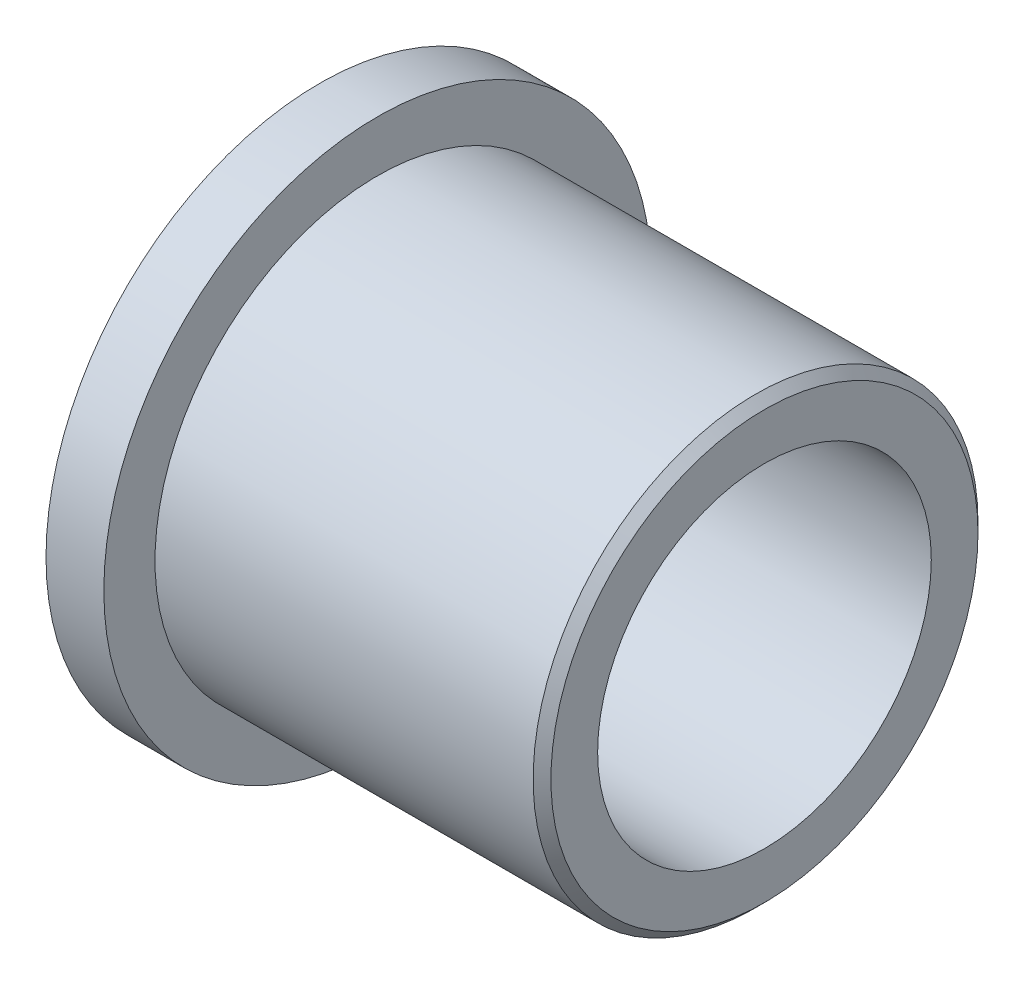
from build123d import *

# Parameters (mm, degrees)
SKETCH1_R                   = 15.621
BOSS_EXTRUDE1_DEPTH         = 3.302
SKETCH2_R                   = 12.7
BOSS_EXTRUDE2_DEPTH         = 22.098
F_3_8_0_75_DIAMETER_HOLE1_D = 19.05
CHAMFER1_SIZE               = 0.508


with BuildPart() as part:
    # Sketch1 → Boss-Extrude1 (new body)
    with BuildSketch(Plane(origin=(0, 0, 0), x_dir=(0, 0, -1), z_dir=(1, 0, 0))):
        with Locations(Location((0, 0, 0), (0, 0, 180))):
            Circle(SKETCH1_R)
    extrude(amount=BOSS_EXTRUDE1_DEPTH)

    # Sketch2 → Boss-Extrude2 (add)
    with BuildSketch(Plane(origin=(3.302, 0, 0), x_dir=(0, 0, -1), z_dir=(1, 0, 0))):
        Circle(SKETCH2_R)
    extrude(amount=BOSS_EXTRUDE2_DEPTH)

    # 3/8 (0.75) Diameter Hole1 (through all)
    with Locations(Plane(origin=(25.4, 0, 0), x_dir=(0, 0, -1), z_dir=(1, 0, 0))):
        with Locations((0, 0)):
            Hole(F_3_8_0_75_DIAMETER_HOLE1_D / 2)

    # Chamfer1
    chamfer1_edges = [part.edges().sort_by_distance(p)[0] for p in [
        (25.4, 0, 12.7),
    ]]
    chamfer(chamfer1_edges, length=CHAMFER1_SIZE)


solid = part.part
